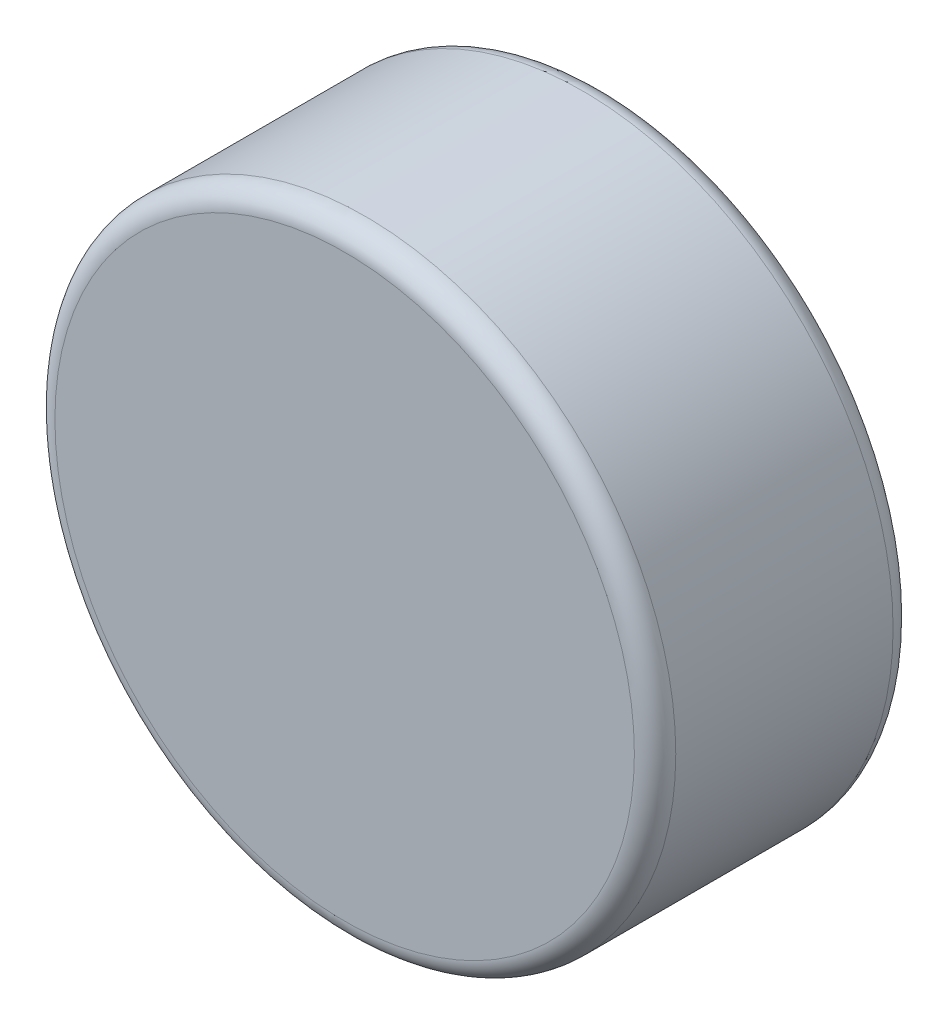
from build123d import *

# Parameters (mm, degrees)
SKETCH_1_R      = 3
EXTRUDE_1_DEPTH = 2.5
FILLET_1_R      = 0.2


with BuildPart() as part:
    # 草图1 → 凸台-拉伸1 (new body)
    with BuildSketch(Plane.XY):
        Circle(SKETCH_1_R)
    extrude(amount=EXTRUDE_1_DEPTH)

    # 圆角1
    fillet_1_edges = [part.edges().sort_by_distance(p)[0] for p in [
        (-3, 0, 0),
        (-3, 0, 2.5),
    ]]
    fillet(fillet_1_edges, radius=FILLET_1_R)


solid = part.part
